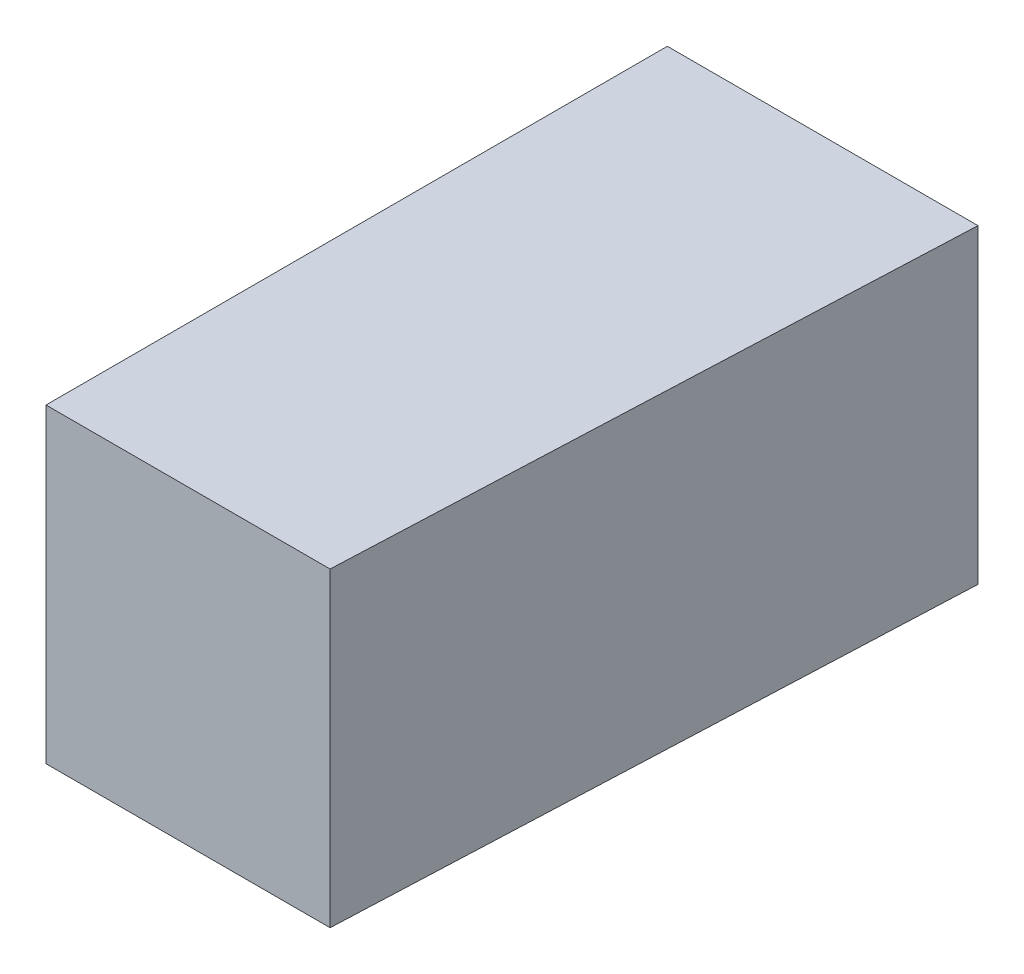
from build123d import *

# Parameters (mm, degrees)
SKETCH4_W           = 10
SKETCH4_H           = 20
BOSS_EXTRUDE1_DEPTH = 10
CUT_EXTRUDE1_DEPTH  = 8
CUT_EXTRUDE2_DEPTH  = 25.494897428


with BuildPart() as part:
    # Sketch4 → Boss-Extrude1 (new body)
    with BuildSketch(Plane(origin=(0, 0, 0), x_dir=(1, 0, 0), z_dir=(0, 1, 0))):
        with Locations((5, 10)):
            Rectangle(SKETCH4_W, SKETCH4_H)
    extrude(amount=BOSS_EXTRUDE1_DEPTH)

    # Sketch2 → Cut-Extrude1 (cut)
    with BuildSketch(Plane(origin=(0, 0, 0), x_dir=(-1, 0, 0), z_dir=(0, -1, 0))):
        Polygon((0, 6.615), (-1.8, 6.615), (-1.8, 4.5), (-3.44, 4.5), (-6.1, 7.16), (-6.1, 12.84), (-3.44, 15.5), (-1.8, 15.5), (-1.8, 13.385), (0, 13.385), align=None)
    extrude(amount=-CUT_EXTRUDE1_DEPTH, mode=Mode.SUBTRACT)

    # Sketch6 → Cut-Extrude2 (cut, through all)
    with BuildSketch(Plane.XZ):
        Polygon((10, 0), (9.144267043, 0), (10, -20), align=None)
    extrude(amount=-CUT_EXTRUDE2_DEPTH, mode=Mode.SUBTRACT)


solid = part.part
